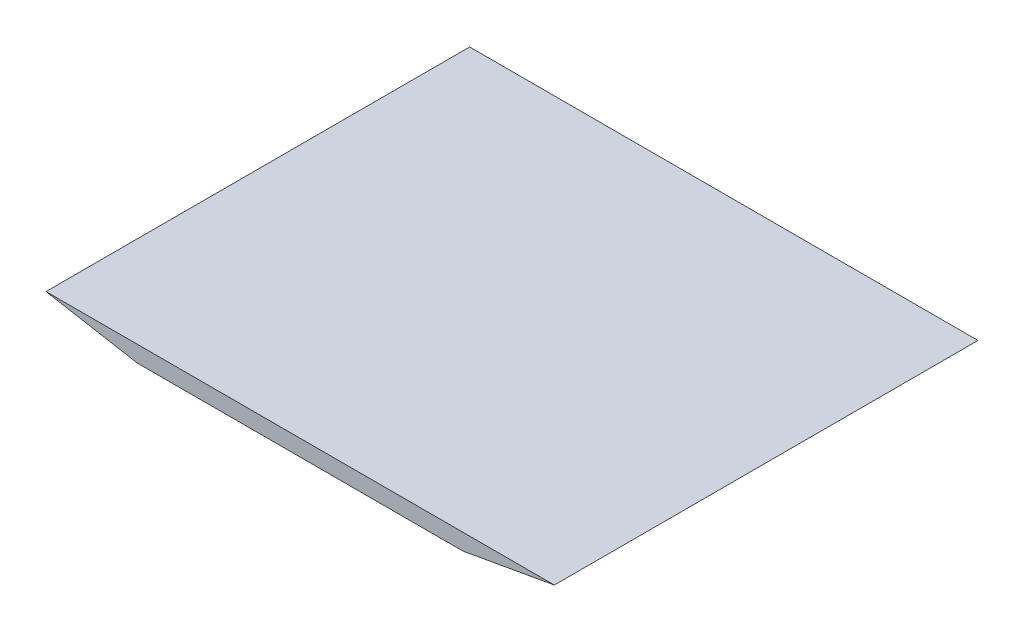
from build123d import *

# Parameters (mm, degrees)
BOSS_EXTRUDE1_DEPTH = 130


with BuildPart() as part:
    # Sketch1 → Boss-Extrude1 (new body)
    with BuildSketch(Plane.XY):
        Polygon((0, 0), (156, 0), (128, -5), (28, -5), align=None)
    extrude(amount=BOSS_EXTRUDE1_DEPTH)


solid = part.part
